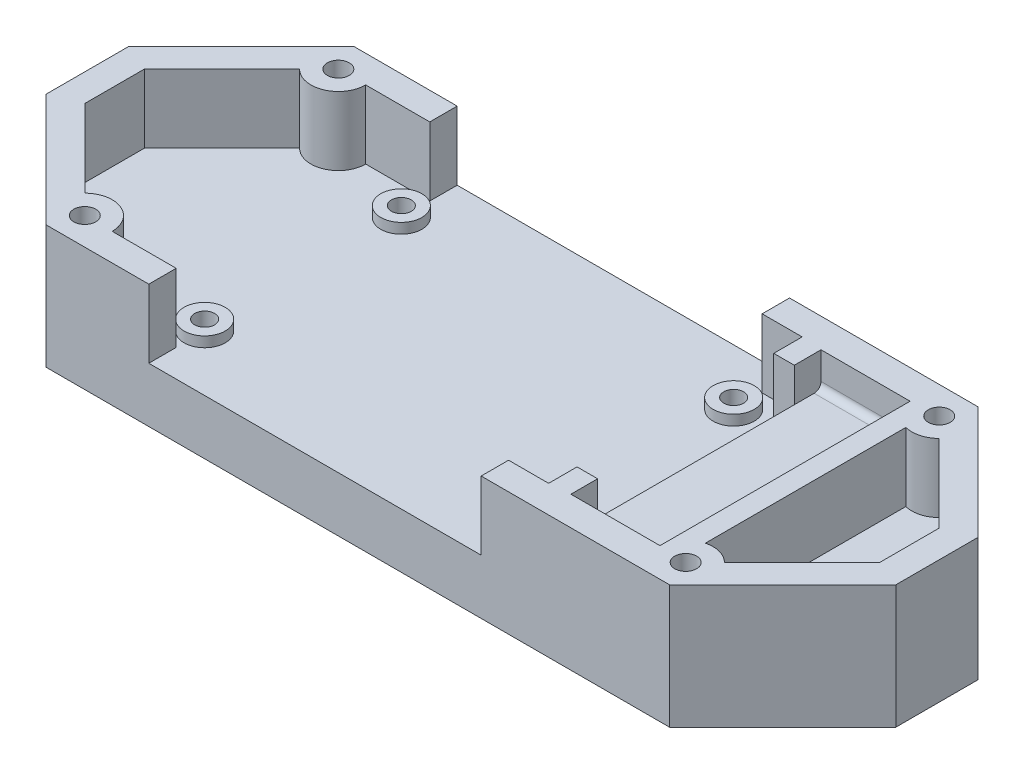
from build123d import *

# Parameters (mm, degrees)
BOSS_EXTRUDE1_DEPTH = 8
BOSS_EXTRUDE2_DEPTH = 10
SKETCH6_R           = 3
BOSS_EXTRUDE3_DEPTH = 1.5
SKETCH7_W           = 48.5
SKETCH7_H           = 4
CUT_EXTRUDE3_DEPTH  = 67.710194124
SKETCH8_W           = 13
SKETCH8_H           = 36.5
BOSS_EXTRUDE4_DEPTH = 10
SKETCH9_W           = 3
SKETCH9_H           = 28.7
CUT_EXTRUDE4_DEPTH  = 67.710194124
SKETCH10_R          = 1.6
CUT_EXTRUDE5_DEPTH  = 69.368486893
SKETCH11_R          = 3
CUT_EXTRUDE6_DEPTH  = 14
SKETCH12_R          = 1.45
CUT_EXTRUDE7_DEPTH  = 6
SKETCH13_W          = 13
SKETCH13_H          = 36.5
BOSS_EXTRUDE5_DEPTH = 5
SKETCH14_R          = 2
CUT_EXTRUDE8_DEPTH  = 5
FILLET1_R           = 1


with BuildPart() as part:
    # Sketch2 → Boss-Extrude1 (new body)
    with BuildSketch(Plane(origin=(0, 0, 0), x_dir=(1, 0, 0), z_dir=(0, 1, 0))):
        Polygon((-62, 6), (-45.5, 22.5), (45.5, 22.5), (62, 6), (62, -6), (45.5, -22.5), (-45.5, -22.5), (-62, -6), align=None)
    extrude(amount=BOSS_EXTRUDE1_DEPTH)

    # Sketch5 → Boss-Extrude2 (add)
    with BuildSketch(Plane(origin=(0, 8, 0), x_dir=(1, 0, 0), z_dir=(0, 1, 0))):
        Polygon((-62, 6), (-62, -6), (-45.5, -22.5), (45.5, -22.5), (62, -6), (62, 6), (45.5, 22.5), (-45.5, 22.5), align=None)
        with BuildLine():
            Line((-58, 4.343145751), (-58, -4.343145751))
            Line((-58, -4.343145751), (-46.671572875, -15.671572875))
            ThreePointArc((-46.671572875, -15.671572875), (-42.312412021, -14.80448187), (-39.843145751, -18.5))
            Line((-39.843145751, -18.5), (39.843145751, -18.5))
            ThreePointArc((39.843145751, -18.5), (42.312412021, -14.80448187), (46.671572875, -15.671572875))
            Line((46.671572875, -15.671572875), (58, -4.343145751))
            Line((58, -4.343145751), (58, 4.343145751))
            Line((58, 4.343145751), (46.671572875, 15.671572875))
            ThreePointArc((46.671572875, 15.671572875), (42.312412021, 14.80448187), (39.843145751, 18.5))
            Line((39.843145751, 18.5), (-39.843145751, 18.5))
            ThreePointArc((-39.843145751, 18.5), (-42.312412021, 14.80448187), (-46.671572875, 15.671572875))
            Line((-46.671572875, 15.671572875), (-58, 4.343145751))
        make_face(mode=Mode.SUBTRACT)
    extrude(amount=BOSS_EXTRUDE2_DEPTH)

    # Sketch6 → Boss-Extrude3 (add)
    with BuildSketch(Plane(origin=(0, 8, 0), x_dir=(1, 0, 0), z_dir=(0, 1, 0))):
        with Locations(Location((18, 14.35, 0), (0, 0, 90))):
            Circle(SKETCH6_R)
        with Locations(Location((-30.5, 14.35, 0), (0, 0, 90))):
            Circle(SKETCH6_R)
        with Locations(Location((-30.5, -14.35, 0), (0, 0, 90))):
            Circle(SKETCH6_R)
        with Locations(Location((18, -14.35, 0), (0, 0, 90))):
            Circle(SKETCH6_R)
    extrude(amount=BOSS_EXTRUDE3_DEPTH)

    # Sketch7 → Cut-Extrude3 (cut, through all)
    with BuildSketch(Plane(origin=(0, 8, 0), x_dir=(1, 0, 0), z_dir=(0, 1, 0))):
        with Locations((-6.25, 20.5)):
            Rectangle(SKETCH7_W, SKETCH7_H)
        with Locations((-6.25, -20.5)):
            Rectangle(SKETCH7_W, SKETCH7_H)
    extrude(amount=CUT_EXTRUDE3_DEPTH, mode=Mode.SUBTRACT)

    # Sketch8 → Boss-Extrude4 (add, through all)
    with BuildSketch(Plane(origin=(0, 8, 0), x_dir=(1, 0, 0), z_dir=(0, 1, 0))):
        with BuildLine():
            Line((23.843145751, 18.5), (23.843145751, -18.5))
            Line((23.843145751, -18.5), (39.843145751, -18.5))
            ThreePointArc((39.843145751, -18.5), (40.68086809, -16.050510257), (42.843145751, -14.627016654))
            Line((42.843145751, -14.627016654), (42.843145751, 14.627016654))
            ThreePointArc((42.843145751, 14.627016654), (40.68086809, 16.050510257), (39.843145751, 18.5))
            Line((39.843145751, 18.5), (23.843145751, 18.5))
        make_face()
        with Locations((33.343145751, 0)):
            Rectangle(SKETCH8_W, SKETCH8_H, mode=Mode.SUBTRACT)
    extrude(amount=BOSS_EXTRUDE4_DEPTH)

    # Sketch9 → Cut-Extrude4 (cut, through all)
    with BuildSketch(Plane(origin=(0, 8, 0), x_dir=(1, 0, 0), z_dir=(0, 1, 0))):
        with Locations((25.343145751, 0)):
            Rectangle(SKETCH9_W, SKETCH9_H)
    extrude(amount=CUT_EXTRUDE4_DEPTH, mode=Mode.SUBTRACT)

    # Sketch10 → Cut-Extrude5 (cut, through all)
    with BuildSketch(Plane(origin=(0, 18, 0), x_dir=(1, 0, 0), z_dir=(0, 1, 0))):
        with Locations(Location((-43.843145751, 18.5, 0), (0, 0, 270))):
            Circle(SKETCH10_R)
        with Locations(Location((43.843145751, 18.5, 0), (0, 0, 270))):
            Circle(SKETCH10_R)
        with Locations(Location((43.843145751, -18.5, 0), (0, 0, 270))):
            Circle(SKETCH10_R)
        with Locations(Location((-43.843145751, -18.5, 0), (0, 0, 270))):
            Circle(SKETCH10_R)
    extrude(amount=-CUT_EXTRUDE5_DEPTH, mode=Mode.SUBTRACT)

    # Sketch11 → Cut-Extrude6 (cut)
    with BuildSketch(Plane.XZ):
        with Locations(Location((-43.843145751, 18.5, 0), (0, 0, 270))):
            Circle(SKETCH11_R)
        with Locations(Location((43.843145751, 18.5, 0), (0, 0, 270))):
            Circle(SKETCH11_R)
        with Locations(Location((43.843145751, -18.5, 0), (0, 0, 270))):
            Circle(SKETCH11_R)
        with Locations(Location((-43.843145751, -18.5, 0), (0, 0, 270))):
            Circle(SKETCH11_R)
    extrude(amount=-CUT_EXTRUDE6_DEPTH, mode=Mode.SUBTRACT)

    # Sketch12 → Cut-Extrude7 (cut)
    with BuildSketch(Plane(origin=(0, 9.5, 0), x_dir=(1, 0, 0), z_dir=(0, 1, 0))):
        with Locations(Location((-30.5, 14.35, 0), (0, 0, 270))):
            Circle(SKETCH12_R)
        with Locations(Location((18, 14.35, 0), (0, 0, 270))):
            Circle(SKETCH12_R)
        with Locations(Location((18, -14.35, 0), (0, 0, 270))):
            Circle(SKETCH12_R)
        with Locations(Location((-30.5, -14.35, 0), (0, 0, 270))):
            Circle(SKETCH12_R)
    extrude(amount=-CUT_EXTRUDE7_DEPTH, mode=Mode.SUBTRACT)

    # Sketch13 → Boss-Extrude5 (add)
    with BuildSketch(Plane(origin=(0, 8, 0), x_dir=(1, 0, 0), z_dir=(0, 1, 0))):
        with Locations((33.343145751, 0)):
            Rectangle(SKETCH13_W, SKETCH13_H)
    extrude(amount=BOSS_EXTRUDE5_DEPTH)

    # Sketch14 → Cut-Extrude8 (cut)
    with BuildSketch(Plane.XZ):
        with Locations(Location((-13.435028843, 13.435028843, 0), (0, 0, 270))):
            Circle(SKETCH14_R)
        with Locations(Location((13.435028843, 13.435028843, 0), (0, 0, 270))):
            Circle(SKETCH14_R)
        with Locations(Location((13.435028843, -13.435028843, 0), (0, 0, 270))):
            Circle(SKETCH14_R)
        with Locations(Location((-13.435028843, -13.435028843, 0), (0, 0, 270))):
            Circle(SKETCH14_R)
    extrude(amount=-CUT_EXTRUDE8_DEPTH, mode=Mode.SUBTRACT)

    # Fillet1
    fillet1_edges = [part.edges().sort_by_distance(p)[0] for p in [
        (33.343145751, 13, -18.25),
        (33.343145751, 13, 18.25),
    ]]
    fillet(fillet1_edges, radius=FILLET1_R)


solid = part.part
